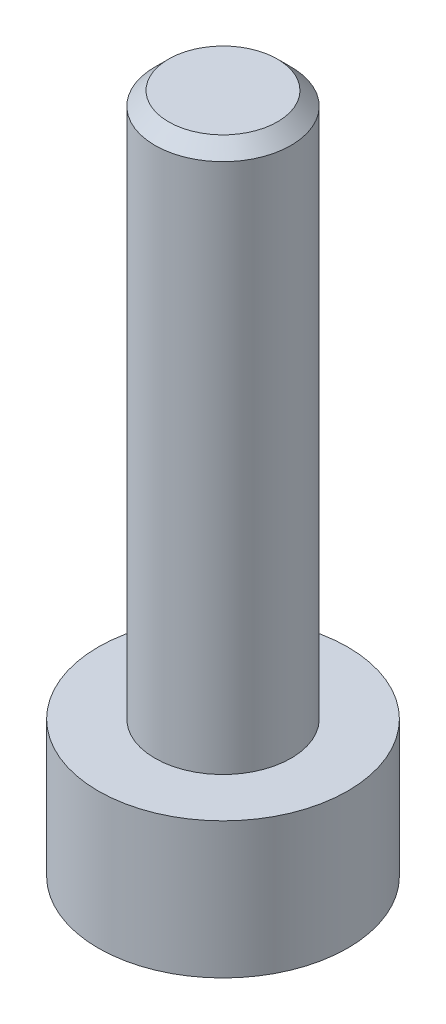
from build123d import *

# Parameters (mm, degrees)
SKETCH_1_R          = 2.75
EXTRUDE_1_DEPTH     = 3
CUT_EXTRUDE_1_DEPTH = 1.5
SKETCH_2_R          = 1.5
EXTRUDE_2_DEPTH     = 12
CHAMFER_1_SIZE      = 0.3


with BuildPart() as part:
    # 草图1 → 凸台-拉伸1 (new body)
    with BuildSketch(Plane(origin=(0, 0, 0), x_dir=(1, 0, 0), z_dir=(0, 1, 0))):
        with Locations(Location((0, 0, 0), (0, 0, 270))):
            Circle(SKETCH_1_R)
    extrude(amount=EXTRUDE_1_DEPTH)

    # 草图3 → 切除-拉伸1 (cut)
    with BuildSketch(Plane.XZ):
        Polygon((0, 1.25), (-1.082531755, 0.625), (-1.082531755, -0.625), (0, -1.25), (1.082531755, -0.625), (1.082531755, 0.625), align=None)
    extrude(amount=-CUT_EXTRUDE_1_DEPTH, mode=Mode.SUBTRACT)

    # 草图2 → 凸台-拉伸2 (add)
    with BuildSketch(Plane(origin=(0, 3, 0), x_dir=(1, 0, 0), z_dir=(0, 1, 0))):
        with Locations(Location((0, 0, 0), (0, 0, 270))):
            Circle(SKETCH_2_R)
    extrude(amount=EXTRUDE_2_DEPTH)

    # 倒角1
    chamfer_1_edges = [part.edges().sort_by_distance(p)[0] for p in [
        (0, 15, -1.5),
    ]]
    chamfer(chamfer_1_edges, length=CHAMFER_1_SIZE)


solid = part.part
